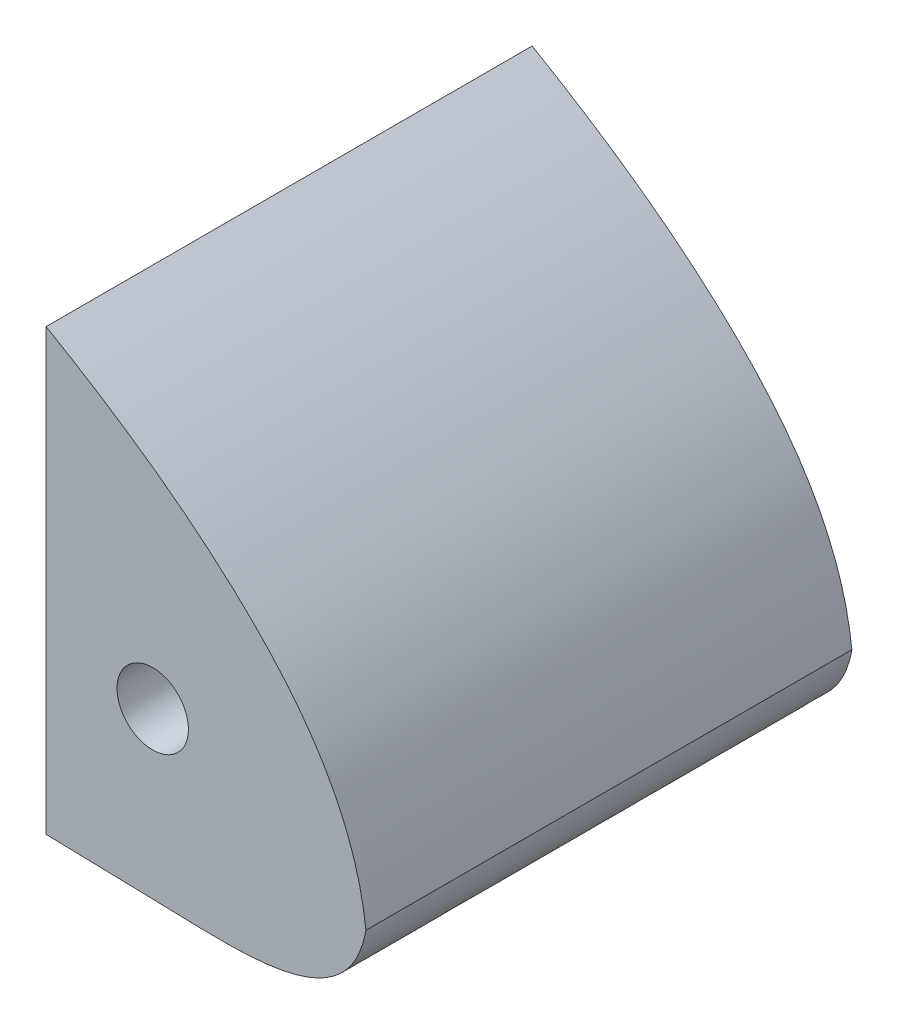
from build123d import *

# Parameters (mm, degrees)
SKETCH1_R           = 2.127
BOSS_EXTRUDE1_DEPTH = 28.956
SKETCH2_W           = 134.292636257
SKETCH2_H           = 53.36276468
CUT_EXTRUDE1_DEPTH  = 28.956


with BuildPart() as part:
    # Sketch1 → Boss-Extrude1 (new body)
    with BuildSketch(Plane.XY):
        with BuildLine():
            Line((-66.006971629, 14.952323969), (-66.006971629, -5.634708623))
            add(Edge.make_bspline(
                [(-66.006971629, -5.634708623), (-44.594037188, -5.53917688), (-13.013022308, -6.724098502), (26.136656569, -12.750856754), (48.765267423, -16.900764204), (64.683362663, -16.969052393), (75.290630493, -17.522529218), (76.216996263, -12.308293591)],
                knots=[0.133250972, 0.133250972, 0.133250972, 0.133250972, 0.517329722, 0.696666541, 0.849409938, 0.919519723, 1, 1, 1, 1], degree=3))
            add(Edge.make_bspline(
                [(76.216996263, -12.308293591), (75.606952539, -6.766559658), (69.704300689, 1.138389205), (56.422236631, 10.264383598), (36.976103105, 19.370772836), (8.741687209, 24.815403957), (-27.455234983, 23.566672909), (-52.387628688, 18.103631651), (-66.006971629, 14.952323969)],
                knots=[0, 0, 0, 0, 0.086586993, 0.161737428, 0.268322265, 0.445156627, 0.638028873, 0.872370876, 0.872370876, 0.872370876, 0.872370876], degree=3))
        make_face()
        with Locations((63.516996263, -7.228293591)):
            Circle(SKETCH1_R, mode=Mode.SUBTRACT)
        with Locations((-25.383003737, 13.091706409)):
            Circle(SKETCH1_R, mode=Mode.SUBTRACT)
    extrude(amount=BOSS_EXTRUDE1_DEPTH)

    # Sketch2 → Cut-Extrude1 (cut)
    with BuildSketch(Plane.XY.offset(28.956)):
        with Locations((-9.979321866, 4.011118028)):
            Rectangle(SKETCH2_W, SKETCH2_H)
    extrude(amount=-CUT_EXTRUDE1_DEPTH, mode=Mode.SUBTRACT)


solid = part.part
